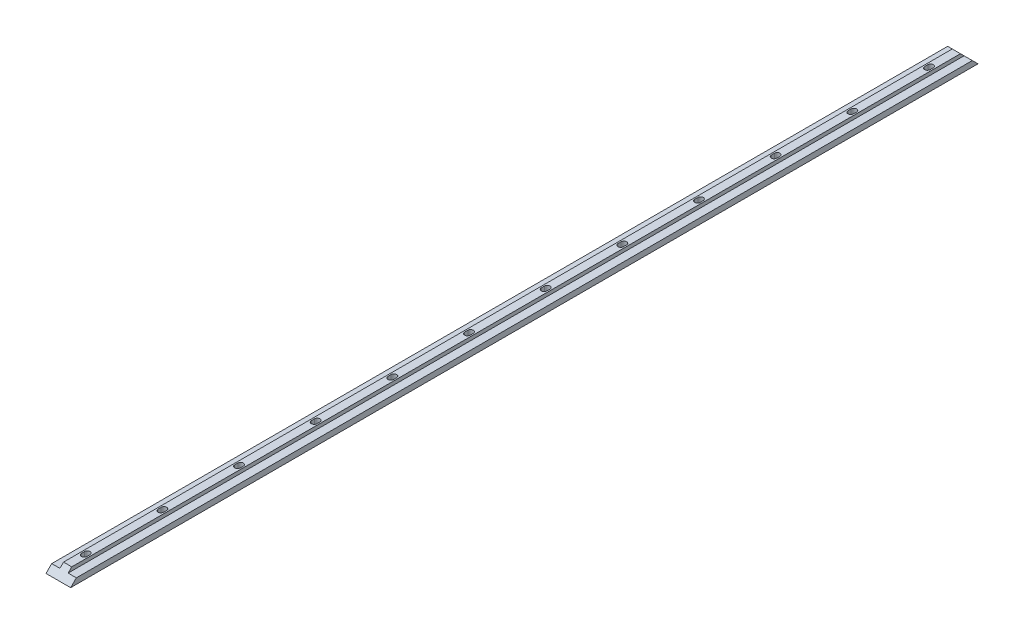
from build123d import *

# Parameters (mm, degrees)
EXTRUDE_1_DEPTH        = 828.5
SKETCH_2_R             = 3.5
CUT_EXTRUDE_1_DEPTH    = 829.979794687
CUT_EXTRUDE_2_DEPTH    = 830.895324725
CUT_EXTRUDE_3_DEPTH    = 10
PATTERN_LINEAR_1_COUNT = 12
PATTERN_LINEAR_1_PITCH = 140


with BuildPart() as part:
    # Эскиз1 → Бобышка-Вытянуть1 (new, symmetric)
    with BuildSketch(Plane.XY):
        Polygon((22.5, 0), (-22.5, 0), (-22.5, 10.4), (-7.5, 10.4), (-7.5, 17), (7.5, 17), (7.5, 10.4), (22.5, 10.4), align=None)
    extrude(amount=EXTRUDE_1_DEPTH, both=True)

    # Эскиз2 → Вырез-Вытянуть1 (cut, through all)
    with BuildSketch(Plane(origin=(0, 17, 0), x_dir=(1, 0, 0), z_dir=(0, 1, 0))):
        with Locations(Location((0, -778.5, 0), (0, 0, 270))):
            Circle(SKETCH_2_R)
        with Locations(Location((0, -638.5, 0), (0, 0, 270))):
            Circle(SKETCH_2_R)
        with Locations(Location((0, -498.5, 0), (0, 0, 270))):
            Circle(SKETCH_2_R)
        with Locations(Location((0, -358.5, 0), (0, 0, 270))):
            Circle(SKETCH_2_R)
        with Locations(Location((0, -218.5, 0), (0, 0, 270))):
            Circle(SKETCH_2_R)
        with Locations(Location((0, -78.5, 0), (0, 0, 270))):
            Circle(SKETCH_2_R)
        with Locations(Location((0, 61.5, 0), (0, 0, 270))):
            Circle(SKETCH_2_R)
        with Locations(Location((0, 201.5, 0), (0, 0, 270))):
            Circle(SKETCH_2_R)
        with Locations(Location((0, 341.5, 0), (0, 0, 270))):
            Circle(SKETCH_2_R)
        with Locations(Location((0, 481.5, 0), (0, 0, 270))):
            Circle(SKETCH_2_R)
    extrude(amount=-CUT_EXTRUDE_1_DEPTH, mode=Mode.SUBTRACT)

    # Эскиз5 → Вырез-Вытянуть2 (cut, through all)
    with BuildSketch(Plane(origin=(22.5, 0, 0), x_dir=(0, 0, -1), z_dir=(1, 0, 0))):
        Polygon((-828.5, 0), (-811.5, 17), (-828.5, 17), align=None)
        Polygon((828.5, 17), (828.5, 0), (811.5, 17), align=None)
    extrude(amount=-CUT_EXTRUDE_2_DEPTH, mode=Mode.SUBTRACT)

    # Эскиз6 → Вырез-Вытянуть3 (cut)
    with BuildSketch(Plane(origin=(0, 17, 0), x_dir=(1, 0, 0), z_dir=(0, 1, 0))):
        with BuildLine():
            Line((-5, -775.613248654), (-5, -781.386751346))
            ThreePointArc((-5, -781.386751346), (0, -786.386751346), (5, -781.386751346))
            Line((5, -781.386751346), (5, -775.613248654))
            ThreePointArc((5, -775.613248654), (0, -770.613248654), (-5, -775.613248654))
        make_face()
    cut_extrude_3 = extrude(amount=-CUT_EXTRUDE_3_DEPTH, mode=Mode.SUBTRACT)

    # Линейный массив1: Вырез-Вытянуть3 ×12
    with Locations(*[(0, 0, -i * PATTERN_LINEAR_1_PITCH) for i in range(1, PATTERN_LINEAR_1_COUNT)]):
        add(cut_extrude_3, mode=Mode.SUBTRACT)


solid = part.part
